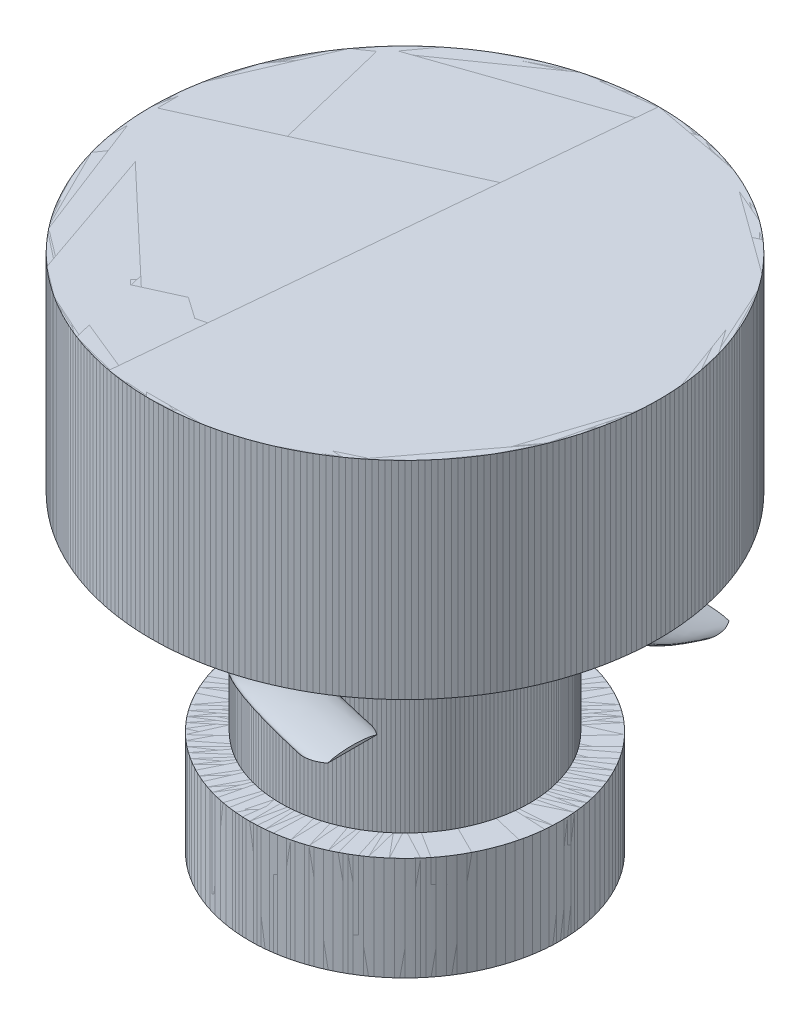
from build123d import *

# Parameters (mm, degrees)
SKETCH4_RX            = 0.762
SKETCH4_RY            = 0.2032
MOAR_SPRINGS_COUNT    = 4
SKETCH5_W             = 2.363152433
SKETCH5_H             = 2.09026795
SKETCH5_W_2           = 1.939146069
SKETCH5_H_2           = 2.115620121
SKETCH5_W_3           = 1.868530061
SKETCH5_H_3           = 1.888921691
SKETCH5_W_4           = 2.298945516
SKETCH5_H_4           = 2.397060666
FLATTEN_SPRINGS_DEPTH = 3.302


with BuildPart() as part:
    # Sketch1 → button body (revolve)
    with BuildSketch(Plane.XY, mode=Mode.PRIVATE) as button_body_sk:
        Polygon((0, 0), (6.223, 0), (6.223, -5.08), (3.048, -5.08), (3.048, -10.16), (3.81, -10.16), (3.81, -12.7), (0, -12.7), align=None)
    revolve(button_body_sk.sketch.rotate(Axis((0, -12.7, 0), (0, 1, 0)), 90), axis=Axis((0, -12.7, 0), (0, 1, 0)))

    # spring: sweep along a path in Sketch2
    with BuildLine() as spring_path:  # in the path sketch's own coordinates; laid on its plane below (add() does not lay a ready-made edge on the line's plane)
        add(Edge.make_bspline(
            [(2.954214398, -4.563042373), (1.853840829, -5.273927005), (-1.483890647, -5.778615601), (3.024167345, -6.982669911)],
            knots=[0, 0, 0, 0, 1, 1, 1, 1], degree=3))
    # Sketch4 → spring (sweep)
    with BuildSketch(Plane.XY.offset(-3.024167345)):
        with Locations(Location((4.318, -6.982669911), (0, 0, 180))):
            Ellipse(SKETCH4_RX, SKETCH4_RY)
    sweep(path=Plane(origin=(4.318, 0, 0), x_dir=(0, 0, -1), z_dir=(1, 0, 0)) * spring_path.line)


with BuildPart() as moar_springs_1:
    # moar springs: pattern copy
    add(part.part.rotate(Axis((0, 0, 0), (0, -1, 0)), 1 * 360 / MOAR_SPRINGS_COUNT))


with BuildPart() as moar_springs_2:
    # moar springs: pattern copy
    add(part.part.rotate(Axis((0, 0, 0), (0, -1, 0)), 2 * 360 / MOAR_SPRINGS_COUNT))


with BuildPart() as moar_springs_3:
    # moar springs: pattern copy
    add(part.part.rotate(Axis((0, 0, 0), (0, -1, 0)), 3 * 360 / MOAR_SPRINGS_COUNT))


with BuildPart() as flatten_springs_tool:
    # Sketch5 → flatten springs (new body)
    with BuildSketch(Plane(origin=(0, -6.858, 0), x_dir=(1, 0, 0), z_dir=(0, 1, 0))):
        with Locations((-4.275716954, -2.460870508)):
            Rectangle(SKETCH5_W, SKETCH5_H)
        with Locations((2.425059371, -4.39592315)):
            Rectangle(SKETCH5_W_2, SKETCH5_H_2)
        with Locations((4.328897436, 2.214260381)):
            Rectangle(SKETCH5_W_3, SKETCH5_H_3)
        with Locations((-2.343935906, 4.35725156)):
            Rectangle(SKETCH5_W_4, SKETCH5_H_4)
    extrude(amount=-FLATTEN_SPRINGS_DEPTH)


with BuildPart() as part_1:
    add(part.part)

    # flatten springs: cut by flatten_springs_tool
    add(flatten_springs_tool.part, mode=Mode.SUBTRACT)


with BuildPart() as moar_springs_1_1:
    add(moar_springs_1.part)

    # flatten springs: cut by flatten_springs_tool
    add(flatten_springs_tool.part, mode=Mode.SUBTRACT)


with BuildPart() as moar_springs_2_1:
    add(moar_springs_2.part)

    # flatten springs: cut by flatten_springs_tool
    add(flatten_springs_tool.part, mode=Mode.SUBTRACT)


with BuildPart() as moar_springs_3_1:
    add(moar_springs_3.part)

    # flatten springs: cut by flatten_springs_tool
    add(flatten_springs_tool.part, mode=Mode.SUBTRACT)


solid = Compound([part_1.part, moar_springs_1_1.part, moar_springs_2_1.part, moar_springs_3_1.part])
